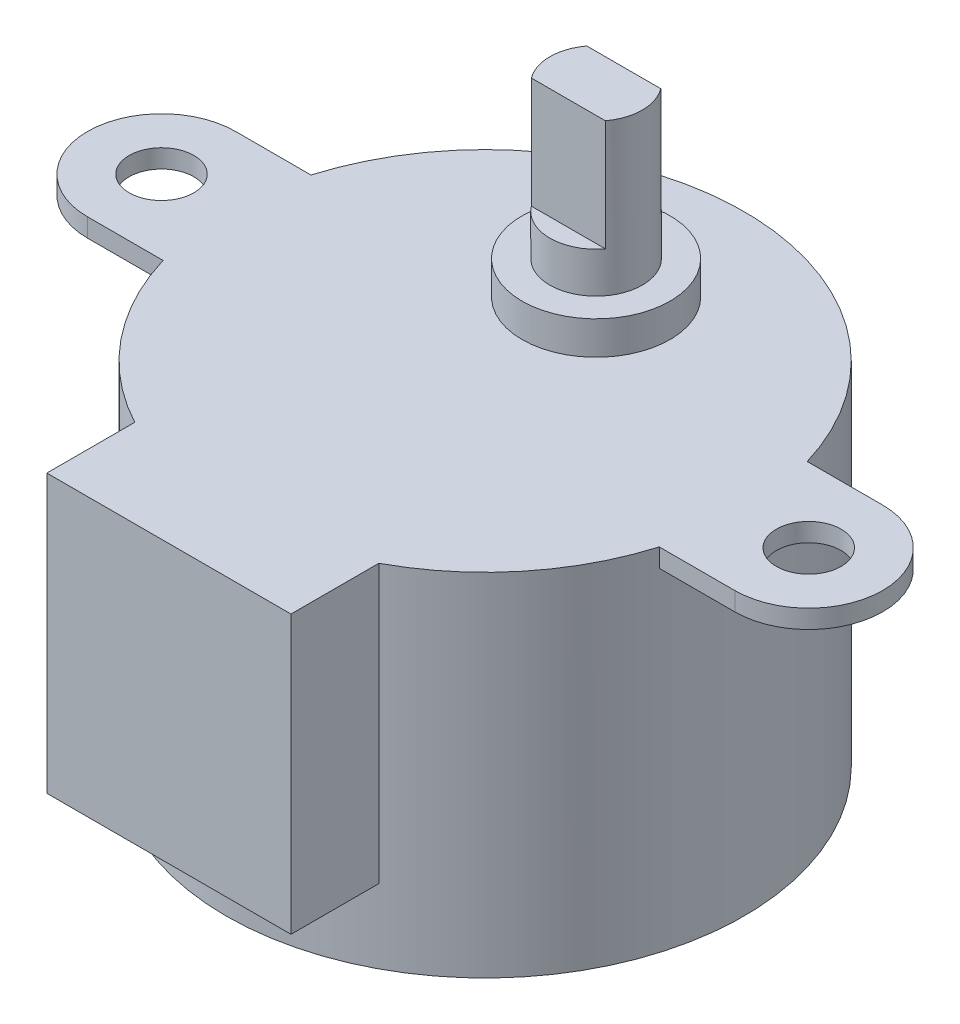
from build123d import *

# Parameters (mm, degrees)
SKETCH_1_R          = 14
EXTRUDE_1_DEPTH     = 19
SKETCH_2_W          = 13.202760332
SKETCH_2_H          = 6.2
EXTRUDE_2_DEPTH     = 15
SKETCH_3_R          = 1.75
EXTRUDE_3_DEPTH     = 1
SKETCH_4_R          = 4
EXTRUDE_4_DEPTH     = 1.8
SKETCH_5_R          = 2.5
EXTRUDE_5_DEPTH     = 8.2
CUT_EXTRUDE_START   = -6
CUT_EXTRUDE_1_DEPTH = 6


with BuildPart() as part:
    # 草图1 → 凸台-拉伸1 (new body)
    with BuildSketch(Plane(origin=(0, 0, 0), x_dir=(1, 0, 0), z_dir=(0, 1, 0))):
        with Locations(Location((0, 0, 0), (0, 0, 270))):
            Circle(SKETCH_1_R)
    extrude(amount=EXTRUDE_1_DEPTH)

    # 草图2 → 凸台-拉伸2 (add)
    with BuildSketch(Plane(origin=(0, 19, 0), x_dir=(1, 0, 0), z_dir=(0, 1, 0))):
        with Locations((0, -14)):
            Rectangle(SKETCH_2_W, SKETCH_2_H)
    extrude(amount=-EXTRUDE_2_DEPTH)

    # 草图3 → 凸台-拉伸3 (add)
    with BuildSketch(Plane(origin=(0, 19, 0), x_dir=(1, 0, 0), z_dir=(0, 1, 0))):
        with BuildLine():
            Line((17.5, -4), (-17.5, -4))
            ThreePointArc((-17.5, -4), (-21.5, 0), (-17.5, 4))
            Line((-17.5, 4), (17.5, 4))
            ThreePointArc((17.5, 4), (21.5, 0), (17.5, -4))
        make_face()
        with Locations(Location((-17.5, 0, 0), (0, 0, 270))):
            Circle(SKETCH_3_R, mode=Mode.SUBTRACT)
        with Locations(Location((17.5, 0, 0), (0, 0, 270))):
            Circle(SKETCH_3_R, mode=Mode.SUBTRACT)
    extrude(amount=-EXTRUDE_3_DEPTH)

    # 草图4 → 凸台-拉伸4 (add)
    with BuildSketch(Plane(origin=(0, 19, 0), x_dir=(1, 0, 0), z_dir=(0, 1, 0))):
        with Locations(Location((0, 6, 0), (0, 0, 270))):
            Circle(SKETCH_4_R)
    extrude(amount=EXTRUDE_4_DEPTH)

    # 草图5 → 凸台-拉伸5 (add)
    with BuildSketch(Plane(origin=(0, 20.8, 0), x_dir=(1, 0, 0), z_dir=(0, 1, 0))):
        with Locations(Location((0, 6, 0), (0, 0, 270))):
            Circle(SKETCH_5_R)
    extrude(amount=EXTRUDE_5_DEPTH)

    # 草图6 → 切除-拉伸1 (cut)
    with BuildSketch(Plane(origin=(0, 29, 0), x_dir=(1, 0, 0), z_dir=(0, 1, 0)).offset(CUT_EXTRUDE_START)):
        with BuildLine():
            Line((2, 4.5), (-2, 4.5))
            ThreePointArc((-2, 4.5), (0, 3.5), (2, 4.5))
        make_face()
        with BuildLine():
            Line((-2, 7.5), (2, 7.5))
            ThreePointArc((2, 7.5), (0, 8.5), (-2, 7.5))
        make_face()
    extrude(amount=CUT_EXTRUDE_1_DEPTH, mode=Mode.SUBTRACT)


solid = part.part
